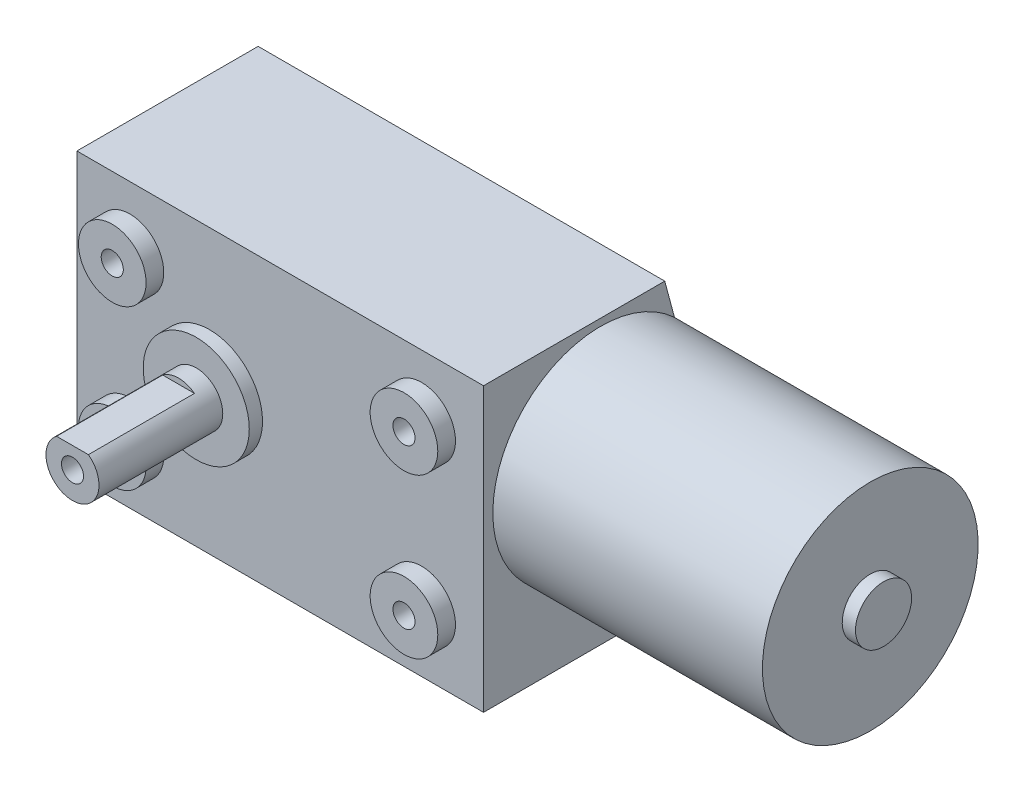
from build123d import *
from OCP.BRepFilletAPI import BRepFilletAPI_MakeChamfer

# Parameters (mm, degrees)
SKETCH3_W             = 46
SKETCH3_H             = 32
BOSS_EXTRUDE1_DEPTH   = 11.25
SKETCH5_R             = 6
SKETCH5_R_2           = 3.825
BOSS_EXTRUDE2_DEPTH   = 1.5
MOVE_FACE1_BY         = 0.5
MOVE_FACE1_2_BY       = 0.5
MOVE_FACE1_3_BY       = 0.5
MOVE_FACE1_4_BY       = 0.5
SKETCH6_R             = 3
BOSS_EXTRUDE3_DEPTH   = 14
SKETCH7_W             = 3.6
SKETCH7_H             = 0.6
CUT_EXTRUDE1_DEPTH    = 12
M3_TAPPED_HOLE1_D     = 2.5
M3_TAPPED_HOLE1_DEPTH = 8.5
M3_TAPPED_HOLE1_TIP   = 0.751075774
M3_TAPPED_HOLE2_D     = 2.5
M3_TAPPED_HOLE2_DEPTH = 8.5
M3_TAPPED_HOLE2_TIP   = 0.751075774
CHAMFER1_SIZE         = 2
CHAMFER1_SIZE2        = 7.464101615
SKETCH13_R            = 12.2
BOSS_EXTRUDE4_DEPTH   = 30.5
SKETCH14_R            = 3.175
BOSS_EXTRUDE6_DEPTH   = 1.5


with BuildPart() as part:
    # Sketch3 → Boss-Extrude1 (new, symmetric)
    with BuildSketch(Plane.XY):
        with Locations((8, 0)):
            Rectangle(SKETCH3_W, SKETCH3_H)
    extrude(amount=BOSS_EXTRUDE1_DEPTH, both=True)

    # Sketch5 → Boss-Extrude2 (add)
    with BuildSketch(Plane.XY.offset(11.25)):
        Circle(SKETCH5_R)
        with Locations((-9, 9)):
            Circle(SKETCH5_R_2)
        with Locations((-9, -9)):
            Circle(SKETCH5_R_2)
        with Locations((24, 9)):
            Circle(SKETCH5_R_2)
        with Locations((24, -9)):
            Circle(SKETCH5_R_2)
    extrude(amount=BOSS_EXTRUDE2_DEPTH)

    # Move Face1: a face moved outward by 0.5
    extrude(part.faces().sort_by_distance((24, -9, 12.75))[0], amount=MOVE_FACE1_BY, dir=(0, 0, 1))

    # Move Face1 2: a face moved outward by 0.5
    extrude(part.faces().sort_by_distance((24, 9, 12.75))[0], amount=MOVE_FACE1_2_BY, dir=(0, 0, 1))

    # Move Face1 3: a face moved outward by 0.5
    extrude(part.faces().sort_by_distance((-9, -9, 12.75))[0], amount=MOVE_FACE1_3_BY, dir=(0, 0, 1))

    # Move Face1 4: a face moved outward by 0.5
    extrude(part.faces().sort_by_distance((-9, 9, 12.75))[0], amount=MOVE_FACE1_4_BY, dir=(0, 0, 1))

    # Sketch6 → Boss-Extrude3 (add)
    with BuildSketch(Plane.XY.offset(12.75)):
        Circle(SKETCH6_R)
    extrude(amount=BOSS_EXTRUDE3_DEPTH)

    # Sketch7 → Cut-Extrude1 (cut)
    with BuildSketch(Plane.XY.offset(26.75)):
        with Locations((0, 2.7)):
            Rectangle(SKETCH7_W, SKETCH7_H)
    extrude(amount=-CUT_EXTRUDE1_DEPTH, mode=Mode.SUBTRACT)

    # M3 Tapped Hole1
    with Locations(Plane.XY.offset(13.25)):
        with Locations((-9, 9), (-9, -9), (24, 9), (24, -9)):
            Hole(M3_TAPPED_HOLE1_D / 2, depth=M3_TAPPED_HOLE1_DEPTH)
            with Locations((0, 0, -(M3_TAPPED_HOLE1_DEPTH + M3_TAPPED_HOLE1_TIP / 2))):  # 118° drill point
                Cone(0, M3_TAPPED_HOLE1_D / 2, M3_TAPPED_HOLE1_TIP, mode=Mode.SUBTRACT)

    # M3 Tapped Hole2
    with Locations(Plane.XY.offset(26.75)):
        with Locations((0, 0)):
            Hole(M3_TAPPED_HOLE2_D / 2, depth=M3_TAPPED_HOLE2_DEPTH)
            with Locations((0, 0, -(M3_TAPPED_HOLE2_DEPTH + M3_TAPPED_HOLE2_TIP / 2))):  # 118° drill point
                Cone(0, M3_TAPPED_HOLE2_D / 2, M3_TAPPED_HOLE2_TIP, mode=Mode.SUBTRACT)

    # Chamfer1: one chamfer whose edges measure the first distance from different faces: ONE call of the kernel's chamfer builder (chamfer() names one face for all edges)
    chamfer1_edges_1 = [part.edges().sort_by_distance(p)[0] for p in [
        (8, 16, -11.25),
    ]]
    chamfer1_side_1 = [part.faces().sort_by_distance(p)[0] for p in [
        (8, 16, 0),
    ]]
    chamfer1_edges_2 = [part.edges().sort_by_distance(p)[0] for p in [
        (8, -16, -11.25),
    ]]
    chamfer1_side_2 = [part.faces().sort_by_distance(p)[0] for p in [
        (8, -16, 0),
    ]]
    chamfer1 = BRepFilletAPI_MakeChamfer(part.part.solid().wrapped)
    for e in chamfer1_edges_1:
        chamfer1.Add(CHAMFER1_SIZE, CHAMFER1_SIZE2, e.wrapped, chamfer1_side_1[0].wrapped)  # the first distance lies on this face
    for e in chamfer1_edges_2:
        chamfer1.Add(CHAMFER1_SIZE, CHAMFER1_SIZE2, e.wrapped, chamfer1_side_2[0].wrapped)  # the first distance lies on this face
    add(Compound.cast(chamfer1.Shape()), mode=Mode.REPLACE)

    # Sketch13 → Boss-Extrude4 (add)
    with BuildSketch(Plane(origin=(31, 0, 0), x_dir=(0, 0, -1), z_dir=(1, 0, 0))):
        with Locations(Location((2, 3, 0), (0, 0, 319.305481692))):
            Circle(SKETCH13_R)
    extrude(amount=BOSS_EXTRUDE4_DEPTH)

    # Sketch14 → Boss-Extrude6 (add)
    with BuildSketch(Plane(origin=(61.5, 0, 0), x_dir=(0, 0, -1), z_dir=(1, 0, 0))):
        with Locations(Location((2, 3, 0), (0, 0, 90))):
            Circle(SKETCH14_R)
    extrude(amount=BOSS_EXTRUDE6_DEPTH)


solid = part.part
